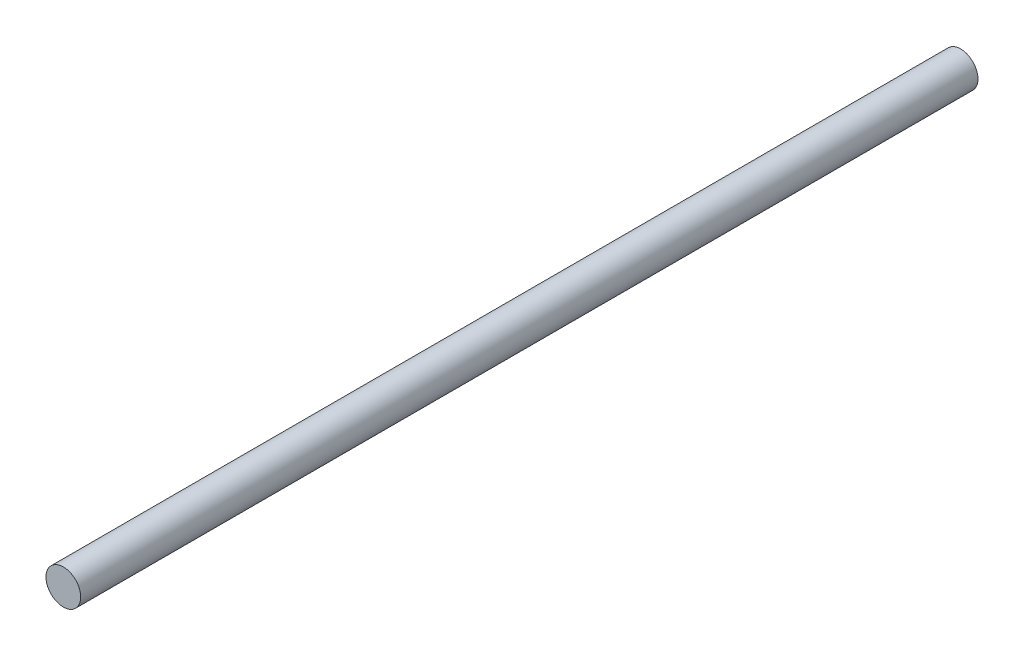
from build123d import *

# Parameters (mm, degrees)
SKETCH_1_R      = 3
EXTRUDE_1_DEPTH = 155


with BuildPart() as part:
    # Эскиз1 → Бобышка-Вытянуть1 (new body)
    with BuildSketch(Plane.XY):
        Circle(SKETCH_1_R)
    extrude(amount=EXTRUDE_1_DEPTH)


solid = part.part
